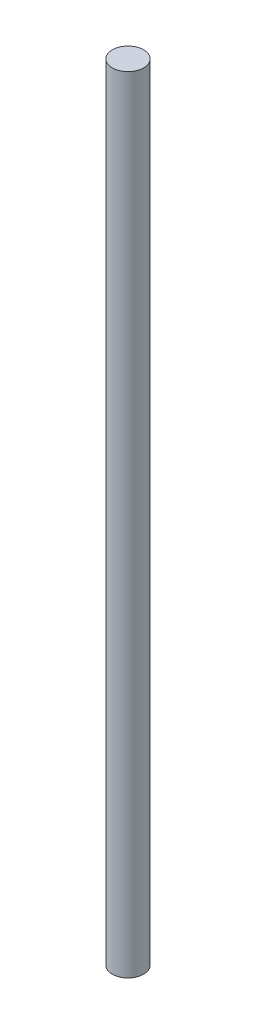
from build123d import *

# Parameters (mm, degrees)
SKETCH1_R    = 1.5
LENGTH_DEPTH = 75


with BuildPart() as part:
    # Sketch1 → Length (new body)
    with BuildSketch(Plane(origin=(0, 0, 0), x_dir=(1, 0, 0), z_dir=(0, 1, 0))):
        with Locations(Location((0, 0, 0), (0, 0, 270))):
            Circle(SKETCH1_R)
    extrude(amount=LENGTH_DEPTH)


solid = part.part
